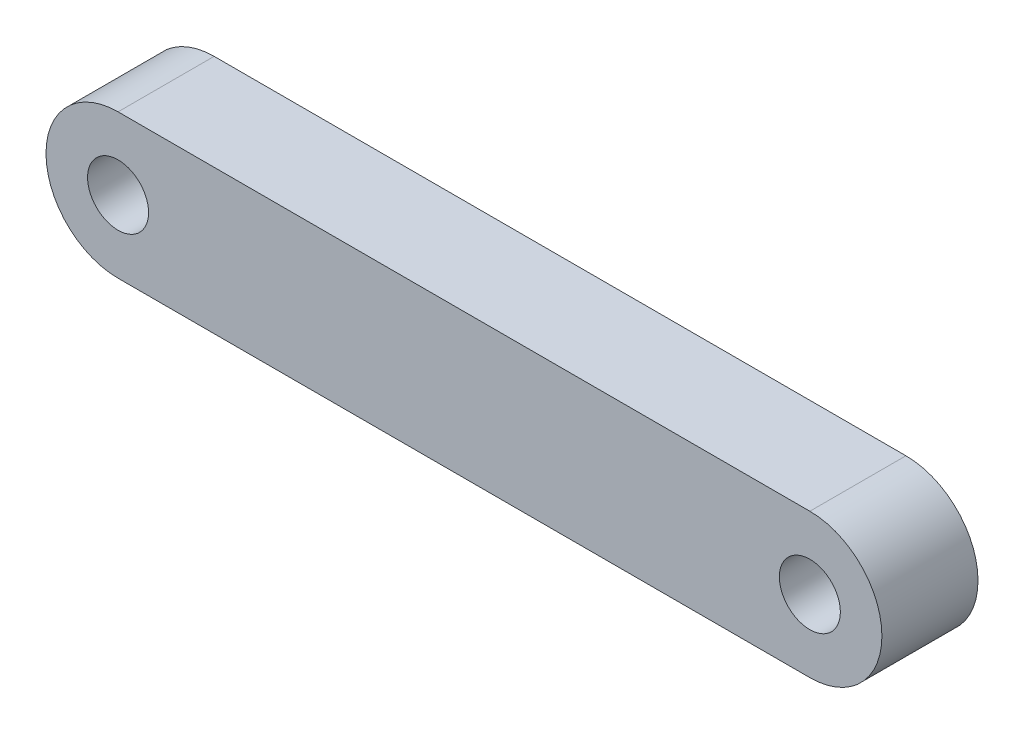
from build123d import *

# Parameters (mm, degrees)
BOSS_EXTRUDE1_DEPTH = 2.5
SKETCH2_R           = 1.5875
CUT_EXTRUDE1_DEPTH  = 23.630178965


with BuildPart() as part:
    # Sketch1 → Boss-Extrude1 (new, symmetric)
    with BuildSketch(Plane.XY):
        with BuildLine():
            Line((-18, 3.75), (18, 3.75))
            ThreePointArc((18, 3.75), (21.75, 0), (18, -3.75))
            Line((18, -3.75), (-18, -3.75))
            ThreePointArc((-18, -3.75), (-21.75, 0), (-18, 3.75))
        make_face()
    extrude(amount=BOSS_EXTRUDE1_DEPTH, both=True)

    # Sketch2 → Cut-Extrude1 (cut, through all)
    with BuildSketch(Plane.XY.offset(2.5)):
        with Locations((-18, 0)):
            Circle(SKETCH2_R)
        with Locations((18, 0)):
            Circle(SKETCH2_R)
    extrude(amount=-CUT_EXTRUDE1_DEPTH, mode=Mode.SUBTRACT)


solid = part.part
